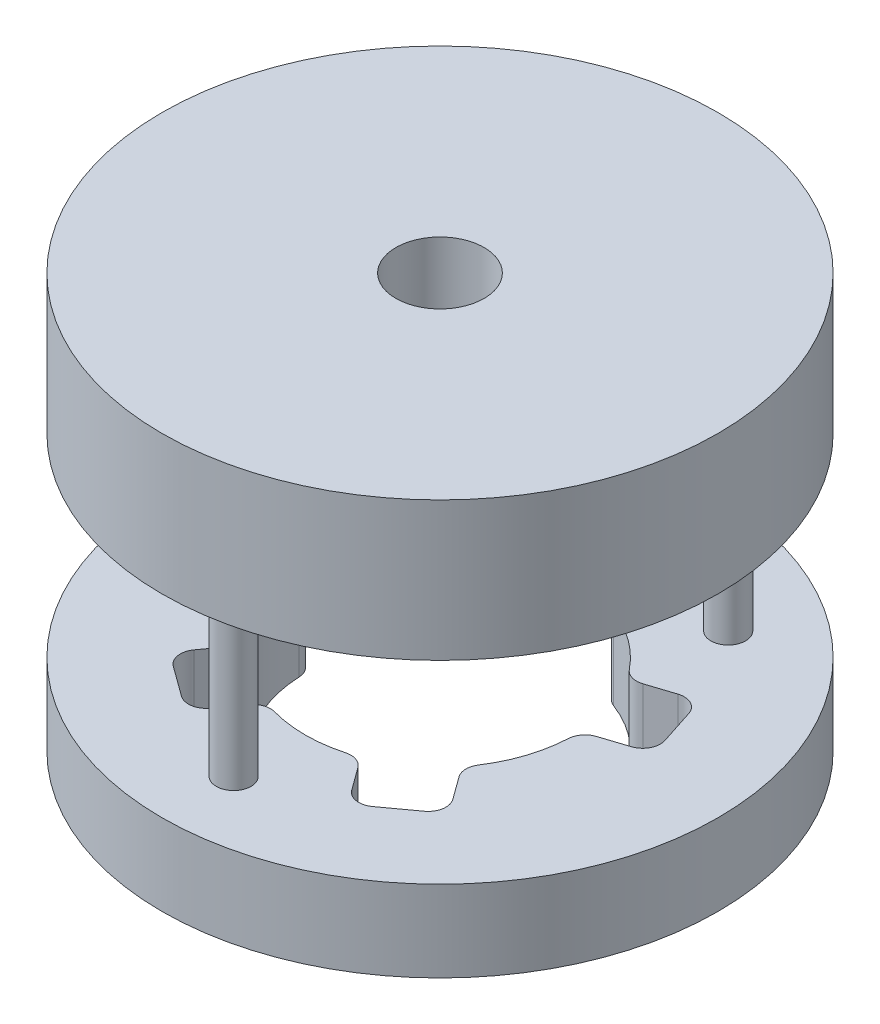
from build123d import *

# Parameters (mm, degrees)
SKETCH1_R           = 40
BOSS_EXTRUDE1_DEPTH = 11.684
SKETCH2_R           = 2.5
BOSS_EXTRUDE2_DEPTH = 27.888000104
SKETCH3_R           = 40
BOSS_EXTRUDE3_DEPTH = 20
FILLET1_R           = 2.54
CUT_EXTRUDE1_REACH  = 84.151
SKETCH4_R           = 6.35


with BuildPart() as part:
    # Sketch1 → Boss-Extrude1 (new body)
    with BuildSketch(Plane(origin=(0, 0, 0), x_dir=(1, 0, 0), z_dir=(0, 1, 0))):
        with Locations(Location((0, 0, 0), (0, 0, 270))):
            Circle(SKETCH1_R)
        with BuildLine():
            ThreePointArc((16.146222613, 10.721189548), (11.392188189, 15.680001858), (5.207, 18.669))
            Line((5.207, 18.669), (5.207, 27.051))
            Line((5.207, 27.051), (-5.207, 27.051))
            Line((-5.207, 27.051), (-5.207, 18.669))
            ThreePointArc((-5.207, 18.669), (-11.392188189, 15.680001858), (-16.146222613, 10.721189548))
            Line((-16.146222613, 10.721189548), (-24.117978333, 13.311369995))
            Line((-24.117978333, 13.311369995), (-27.336081312, 3.407067434))
            Line((-27.336081312, 3.407067434), (-19.364325592, 0.816886988))
            ThreePointArc((-19.364325592, 0.816886988), (-18.432947696, -5.989227766), (-15.185914365, -12.042940459))
            Line((-15.185914365, -12.042940459), (-20.112730349, -18.824120906))
            Line((-20.112730349, -18.824120906), (-11.68762737, -24.945316524))
            Line((-11.68762737, -24.945316524), (-6.760811385, -18.164136077))
            ThreePointArc((-6.760811385, -18.164136077), (0, -19.381548184), (6.760811385, -18.164136077))
            Line((6.760811385, -18.164136077), (11.68762737, -24.945316524))
            Line((11.68762737, -24.945316524), (20.112730349, -18.824120906))
            Line((20.112730349, -18.824120906), (15.185914365, -12.042940459))
            ThreePointArc((15.185914365, -12.042940459), (18.432947696, -5.989227766), (19.364325592, 0.816886988))
            Line((19.364325592, 0.816886988), (27.336081312, 3.407067434))
            Line((27.336081312, 3.407067434), (24.117978333, 13.311369995))
            Line((24.117978333, 13.311369995), (16.146222613, 10.721189548))
        make_face(mode=Mode.SUBTRACT)
    extrude(amount=BOSS_EXTRUDE1_DEPTH)

    # Sketch2 → Boss-Extrude2 (add)
    with BuildSketch(Plane(origin=(0, 11.684, 0), x_dir=(1, 0, 0), z_dir=(0, 1, 0))):
        with Locations(Location((-17.45179914, 24.020340816, 0), (0, 0, 270))):
            Circle(SKETCH2_R)
        with Locations(Location((17.45179914, 24.020340816, 0), (0, 0, 270))):
            Circle(SKETCH2_R)
        with Locations(Location((0, -29.690774092, 0), (0, 0, 270))):
            Circle(SKETCH2_R)
    extrude(amount=BOSS_EXTRUDE2_DEPTH)

    # Sketch3 → Boss-Extrude3 (add)
    with BuildSketch(Plane(origin=(0, 39.572000104, 0), x_dir=(1, 0, 0), z_dir=(0, 1, 0))):
        with Locations(Location((0, 0, 0), (0, 0, 270))):
            Circle(SKETCH3_R)
    extrude(amount=BOSS_EXTRUDE3_DEPTH)

    # Fillet1
    fillet1_edges = [part.edges().sort_by_distance(p)[0] for p in [
        (5.207, 5.842, -18.669),
        (5.207, 5.842, -27.051),
        (-5.207, 5.842, -27.051),
        (-5.207, 5.842, -18.669),
        (-16.146222613, 5.842, -10.721189548),
        (-24.117978333, 5.842, -13.311369995),
        (-27.336081312, 5.842, -3.407067434),
        (-19.364325592, 5.842, -0.816886988),
        (-15.185914365, 5.842, 12.042940459),
        (-20.112730349, 5.842, 18.824120906),
        (-11.68762737, 5.842, 24.945316524),
        (-6.760811385, 5.842, 18.164136077),
        (6.760811385, 5.842, 18.164136077),
        (11.68762737, 5.842, 24.945316524),
        (20.112730349, 5.842, 18.824120906),
        (15.185914365, 5.842, 12.042940459),
        (19.364325592, 5.842, -0.816886988),
        (27.336081312, 5.842, -3.407067434),
        (24.117978333, 5.842, -13.311369995),
        (16.146222613, 5.842, -10.721189548),
    ]]
    fillet(fillet1_edges, radius=FILLET1_R)

    # Sketch4 → Cut-Extrude1 (cut, up to next)
    with BuildSketch(Plane(origin=(0, 59.572000104, 0), x_dir=(1, 0, 0), z_dir=(0, 1, 0)), mode=Mode.PRIVATE) as cut_extrude1_sk1:
        with Locations(Location((0, 0, 0), (0, 0, 270))):
            Circle(SKETCH4_R)
    cut_extrude1_tool1 = extrude(cut_extrude1_sk1.sketch, amount=-CUT_EXTRUDE1_REACH, mode=Mode.PRIVATE) & part.part
    add(cut_extrude1_tool1.solids().sort_by_distance((0, 59.572, 0))[0], mode=Mode.SUBTRACT)


solid = part.part
